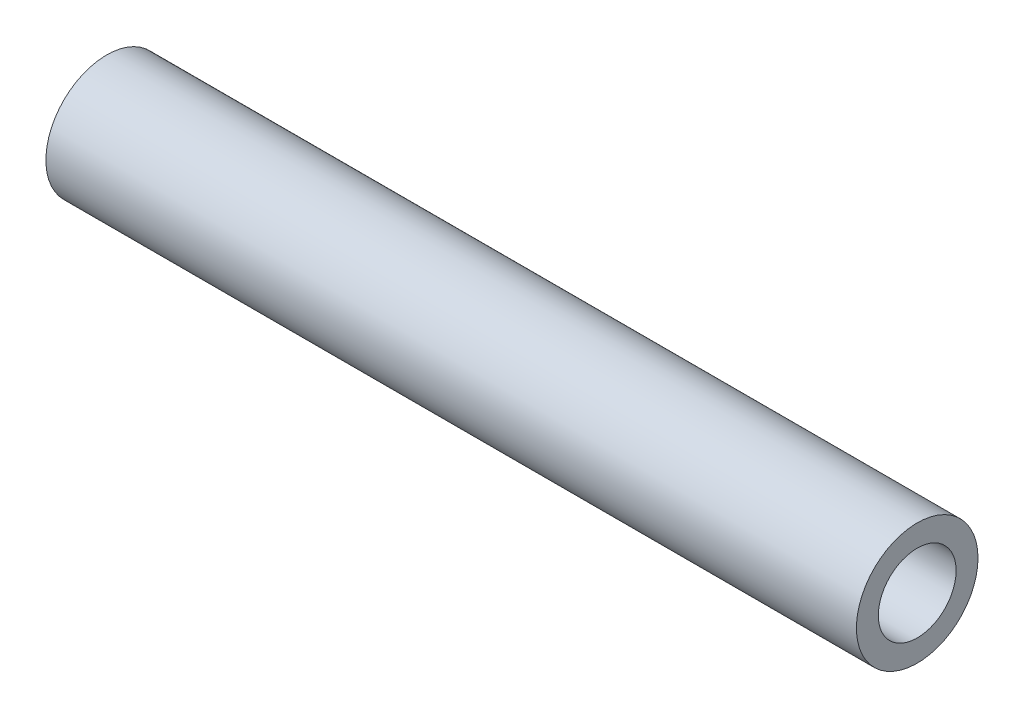
from build123d import *

# Parameters (mm, degrees)
SKETCH1_R           = 3.81
SKETCH1_R_2         = 2.4384
BOSS_EXTRUDE1_DEPTH = 50.8


with BuildPart() as part:
    # Sketch1 → Boss-Extrude1 (new body)
    with BuildSketch(Plane(origin=(0, 0, 0), x_dir=(0, 0, -1), z_dir=(1, 0, 0))):
        Circle(SKETCH1_R)
        Circle(SKETCH1_R_2, mode=Mode.SUBTRACT)
    extrude(amount=BOSS_EXTRUDE1_DEPTH)


solid = part.part
